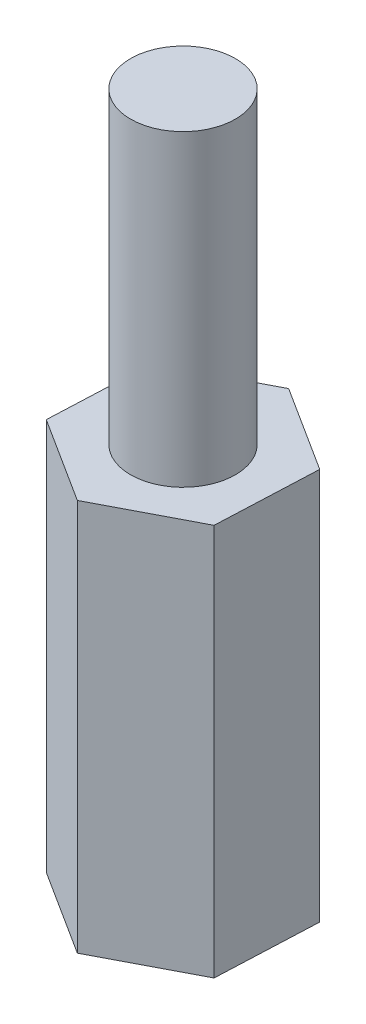
from build123d import *

# Parameters (mm, degrees)
BOSS_EXTRUDE1_DEPTH = 25
SKETCH2_OUTSIDE_W   = 13.782
SKETCH2_OUTSIDE_H   = 14.596
SKETCH2_OUTSIDE_R   = 1.873084861
CUT_EXTRUDE1_DEPTH  = 11


with BuildPart() as part:
    # Sketch1 → Boss-Extrude1 (new body)
    with BuildSketch(Plane(origin=(0, 0, 0), x_dir=(1, 0, 0), z_dir=(0, 1, 0))):
        Polygon((3.210447175, 1.67252173), (0.156777281, 3.616589676), (-3.053669894, 1.944067946), (-3.210447175, -1.67252173), (-0.156777281, -3.616589676), (3.053669894, -1.944067946), align=None)
    extrude(amount=BOSS_EXTRUDE1_DEPTH)

    # Sketch2 outside → Cut-Extrude1 (cut)
    with BuildSketch(Plane(origin=(0, 25, 0), x_dir=(1, 0, 0), z_dir=(0, 1, 0))):
        Rectangle(SKETCH2_OUTSIDE_W, SKETCH2_OUTSIDE_H)
        with Locations(Location((0, 0, 0), (0, 0, 270))):
            Circle(SKETCH2_OUTSIDE_R, mode=Mode.SUBTRACT)
    extrude(amount=-CUT_EXTRUDE1_DEPTH, mode=Mode.SUBTRACT)


solid = part.part
